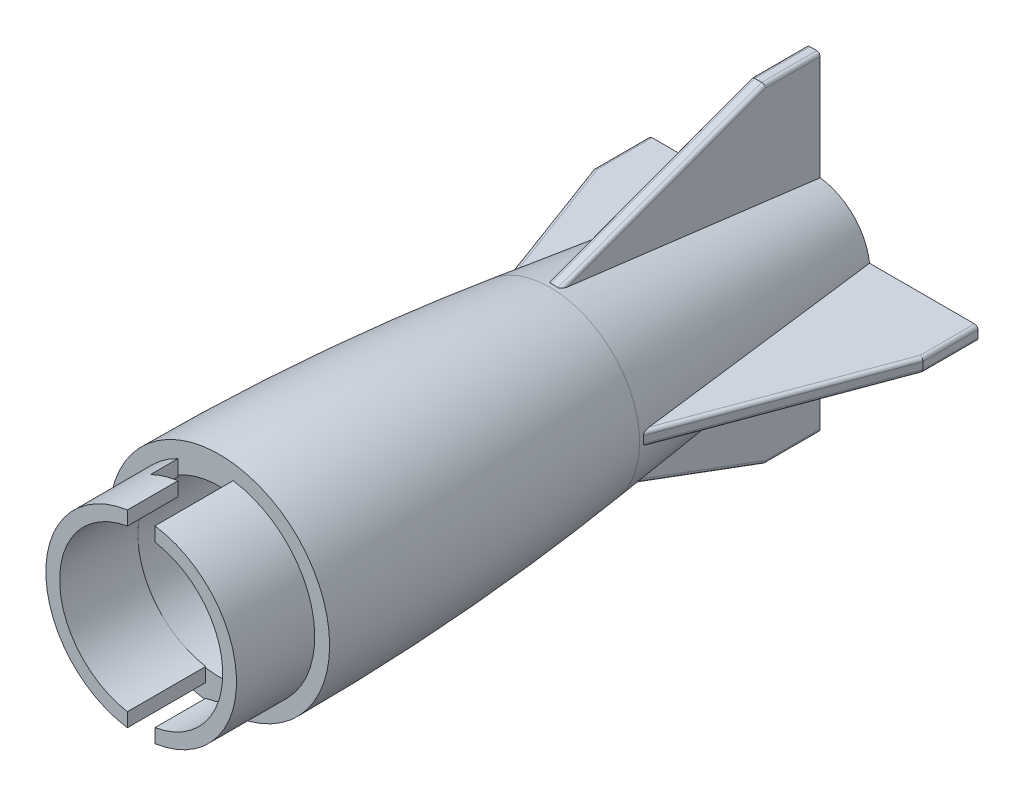
from build123d import *

# Parameters (mm, degrees)
BOSS_EXTRUDE2_DEPTH      = 0.79375
FILLET2_R                = 0.396875
CIRPATTERN5_COUNT        = 4
FILLET2_OF_CIRPATTERN5_R = 0.396875
SKETCH6_R                = 10.9855
SKETCH6_R_2              = 9.398
BOSS_EXTRUDE3_DEPTH      = 9.017
CUT_EXTRUDE1_DEPTH       = 129.426706448
CUT_EXTRUDE2_REACH       = 130.427
CUT_EXTRUDE2_END_RADIUS  = 10.9855


with BuildPart() as part:
    # Sketch3 → Revolve2 (revolve)
    with BuildSketch(Plane(origin=(0, 0, 0), x_dir=(0, 0, -1), z_dir=(1, 0, 0))):
        with BuildLine():
            Line((57.15, 12.7), (57.15, 9.525))
            Line((57.15, 9.525), (91.893227671, 9.525))
            ThreePointArc((91.893227671, 9.525), (102.982534669, 8.29739345), (113.534829541, 4.674022024))
            ThreePointArc((113.534829541, 4.674022024), (115.069002319, 4.147228765), (116.68125, 3.96875))
            Line((116.68125, 3.96875), (120.65, 3.96875))
            Line((120.65, 3.96875), (120.65, 3.175))
            Line((120.65, 3.175), (122.2375, 3.175))
            Line((122.2375, 3.175), (125.59178364, 6.52928364))
            Line((125.59178364, 6.52928364), (95.25, 10.32569244))
            ThreePointArc((95.25, 10.32569244), (76.236954553, 12.105847936), (57.15, 12.7))
        make_face()
    revolve(axis=Axis((0, 0, 0), (0, 0, -1)))

    # Sketch5 → Boss-Extrude2 (add, symmetric)
    with BuildSketch(Plane(origin=(0, 0, 0), x_dir=(0, 0, -1), z_dir=(1, 0, 0))):
        Polygon((125.59178364, 18.97528364), (119.24178364, 18.97528364), (95.25, 10.07169244), (125.59178364, 6.27528364), align=None)
    boss_extrude2 = extrude(amount=BOSS_EXTRUDE2_DEPTH, both=True)

    # Fillet2
    fillet2_edges = [part.edges().sort_by_distance(p)[0] for p in [
        (0.79375, 18.97528364, -122.41678364),
        (-0.79375, 18.97528364, -122.41678364),
        (0.79375, 14.606978185, -107.47086593),
        (-0.79375, 14.606978185, -107.47086593),
    ]]
    fillet(fillet2_edges, radius=FILLET2_R)

    # CirPattern5: Boss-Extrude2 ×4 about axis
    cirpattern5_axis = Axis((0, 0, -122.2375), (0, 0, 1))
    for i in range(1, CIRPATTERN5_COUNT):
        add(boss_extrude2.rotate(cirpattern5_axis, i * 360 / CIRPATTERN5_COUNT))

    # Fillet2 of CirPattern5
    fillet2_of_cirpattern5_edges = [part.edges().sort_by_distance(p)[0] for p in [
        (-18.97528364, 0.79375, -122.41678364),
        (-18.97528364, -0.79375, -122.41678364),
        (-14.606978185, 0.79375, -107.47086593),
        (-14.606978185, -0.79375, -107.47086593),
        (-0.79375, -18.97528364, -122.41678364),
        (0.79375, -18.97528364, -122.41678364),
        (-0.79375, -14.606978185, -107.47086593),
        (0.79375, -14.606978185, -107.47086593),
        (18.97528364, -0.79375, -122.41678364),
        (18.97528364, 0.79375, -122.41678364),
        (14.606978185, -0.79375, -107.47086593),
        (14.606978185, 0.79375, -107.47086593),
    ]]
    fillet(fillet2_of_cirpattern5_edges, radius=FILLET2_OF_CIRPATTERN5_R)

    # Sketch6 → Boss-Extrude3 (add)
    with BuildSketch(Plane.XY.offset(-57.15)):
        Circle(SKETCH6_R)
        Circle(SKETCH6_R_2, mode=Mode.SUBTRACT)
    extrude(amount=BOSS_EXTRUDE3_DEPTH)

    # Sketch8 → Cut-Extrude1 (cut, through all)
    with BuildSketch(Plane(origin=(0, 0, 0), x_dir=(1, 0, 0), z_dir=(0, 1, 0))):
        Polygon((-1.5875, 39.116), (1.5875, 39.116), (1.5875, 53.975), (4.7625, 53.975), (4.7625, 57.15), (-1.5875, 57.15), align=None)
    extrude(amount=-CUT_EXTRUDE1_DEPTH, mode=Mode.SUBTRACT)

    # Cut-Extrude2: up to this cylinder (the profile starts inside it)
    cut_extrude2_end = Plane(origin=(0, 0, -49.245201), z_dir=(0, 0, -1)) * Cylinder(CUT_EXTRUDE2_END_RADIUS, 283.825, mode=Mode.PRIVATE)
    # Sketch8<3> → Cut-Extrude2 (cut, up to the surface)
    with BuildSketch(Plane(origin=(0, 0, 0), x_dir=(1, 0, 0), z_dir=(0, 1, 0)), mode=Mode.PRIVATE) as cut_extrude2_sk1:
        Polygon((-1.5875, 39.116), (1.5875, 39.116), (1.5875, 57.15), (-4.7625, 57.15), (-4.7625, 53.975), (-1.5875, 53.975), align=None)
    cut_extrude2_tool1 = extrude(cut_extrude2_sk1.sketch, amount=CUT_EXTRUDE2_REACH, mode=Mode.PRIVATE) & cut_extrude2_end
    add(cut_extrude2_tool1.solids().sort_by_distance((-0.475299, 0, -49.245201))[0], mode=Mode.SUBTRACT)


solid = part.part
